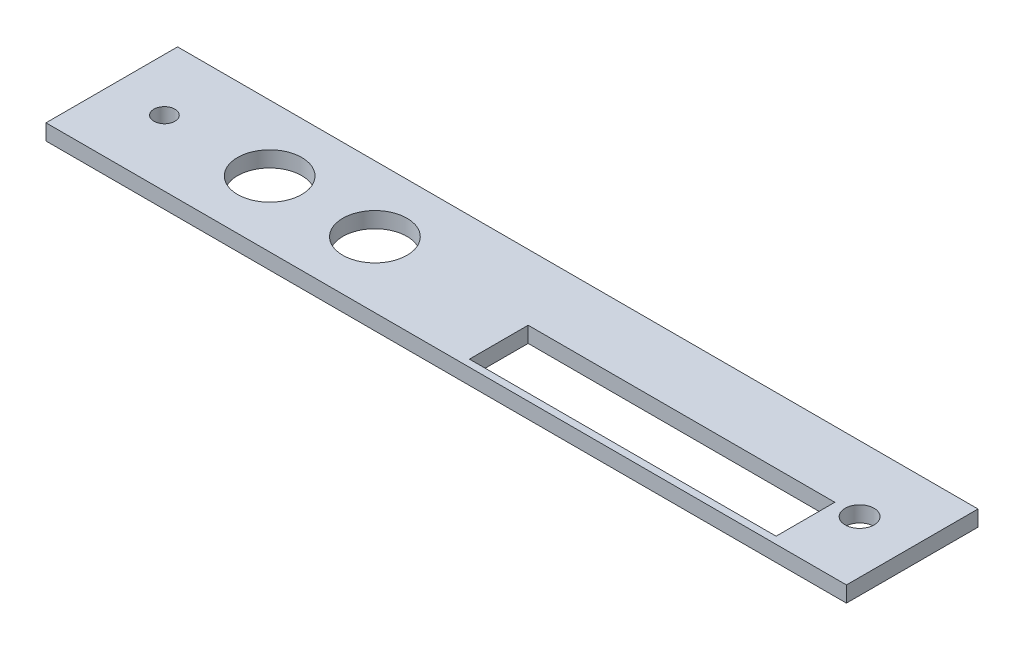
from build123d import *

# Parameters (mm, degrees)
ESQUISSE1_W             = 152.1
ESQUISSE1_H             = 25
ESQUISSE1_R             = 2.75
ESQUISSE1_R_2           = 2
BOSS_EXTRU_1_DEPTH      = 3
ESQUISSE3_R             = 6.1
ESQUISSE3_W             = 58.273048821
ESQUISSE3_H             = 11.159952414
ENL_V_MAT_EXTRU_2_DEPTH = 78.977892392


with BuildPart() as part:
    # Esquisse1 → Boss.-Extru.1 (new body)
    with BuildSketch(Plane(origin=(0, 0, 0), x_dir=(1, 0, 0), z_dir=(0, 1, 0))):
        with Locations((-0.495280426, -2.072980011)):
            Rectangle(ESQUISSE1_W, ESQUISSE1_H)
        with Locations(Location((65.554719574, -2.072980011, 0), (0, 0, 270))):
            Circle(ESQUISSE1_R, mode=Mode.SUBTRACT)
        with Locations(Location((-66.545280426, -2.072980011, 0), (0, 0, 270))):
            Circle(ESQUISSE1_R_2, mode=Mode.SUBTRACT)
    extrude(amount=BOSS_EXTRU_1_DEPTH)

    # Esquisse3 → Enlèv. mat.-Extru.2 (cut, through all)
    with BuildSketch(Plane(origin=(0, 0, 0), x_dir=(1, 0, 0), z_dir=(0, 1, 0))):
        with Locations(Location((-46.545280426, -2.072980011, 0), (0, 0, 270))):
            Circle(ESQUISSE3_R)
        with Locations(Location((-26.545280426, -2.072980011, 0), (0, 0, 270))):
            Circle(ESQUISSE3_R)
        with Locations((31.710873838, -7.652956218)):
            Rectangle(ESQUISSE3_W, ESQUISSE3_H)
    extrude(amount=ENL_V_MAT_EXTRU_2_DEPTH, mode=Mode.SUBTRACT)


solid = part.part
